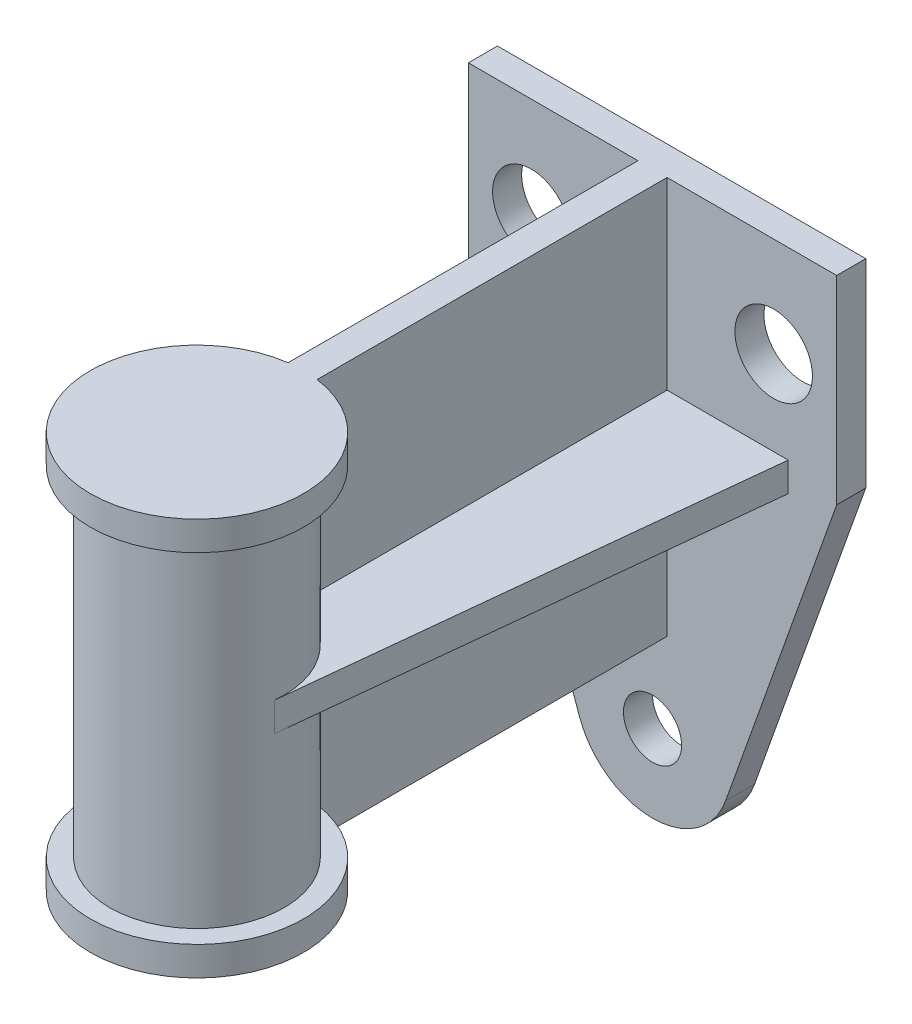
from build123d import *

# Parameters (mm, degrees)
SKETCH1_R           = 18
BOSS_EXTRUDE1_DEPTH = 41
SKETCH3_R           = 6
BOSS_EXTRUDE2_DEPTH = 6
SKETCH4_W           = 81
SKETCH4_H           = 82
BOSS_EXTRUDE3_DEPTH = 3
SKETCH6_R           = 22
BOSS_EXTRUDE4_DEPTH = 6
BOSS_EXTRUDE5_START = -6
SKETCH7_R           = 22
BOSS_EXTRUDE5_DEPTH = 6
BOSS_EXTRUDE6_DEPTH = 3
HOLE1_D             = 16
HOLE1_DEPTH         = 6


with BuildPart() as part:
    # Sketch1 → Boss-Extrude1 (new, symmetric)
    with BuildSketch(Plane(origin=(0, 0, 0), x_dir=(1, 0, 0), z_dir=(0, 1, 0))):
        with Locations(Location((0, 0, 0), (0, 0, 270))):
            Circle(SKETCH1_R)
    extrude(amount=BOSS_EXTRUDE1_DEPTH, both=True)



with BuildPart() as body_2:
    # Sketch3 → Boss-Extrude2 (new body)
    with BuildSketch(Plane.XY.offset(-100)):
        with BuildLine():
            Line((-38, 41), (38, 41))
            Line((38, 41), (38, 0))
            Line((38, 0), (15.072405416, -64.368667895))
            ThreePointArc((15.072405416, -64.368667895), (0, -75), (-15.072405416, -64.368667895))
            Line((-15.072405416, -64.368667895), (-38, 0))
            Line((-38, 0), (-38, 41))
        make_face()
        with Locations((0, -59)):
            Circle(SKETCH3_R, mode=Mode.SUBTRACT)
    extrude(amount=BOSS_EXTRUDE2_DEPTH)


with BuildPart() as part_1:
    add(part.part)

    add(body_2.part)  # Boss-Extrude3 merges body 2
    # Sketch4 → Boss-Extrude3 (add, symmetric)
    with BuildSketch(Plane(origin=(0, 0, 0), x_dir=(0, 0, -1), z_dir=(1, 0, 0))):
        with Locations((53.5, 0)):
            Rectangle(SKETCH4_W, SKETCH4_H)
    extrude(amount=BOSS_EXTRUDE3_DEPTH, both=True)

    # Sketch6 → Boss-Extrude4 (add)
    with BuildSketch(Plane(origin=(0, 41, 0), x_dir=(1, 0, 0), z_dir=(0, 1, 0))):
        Circle(SKETCH6_R)
    extrude(amount=-BOSS_EXTRUDE4_DEPTH)

    # Sketch7 → Boss-Extrude5 (add)
    with BuildSketch(Plane.XZ.offset(41).offset(BOSS_EXTRUDE5_START)):
        Circle(SKETCH7_R)
    extrude(amount=BOSS_EXTRUDE5_DEPTH)

    # Sketch8 → Boss-Extrude6 (add, symmetric)
    with BuildSketch(Plane(origin=(0, 0, 0), x_dir=(1, 0, 0), z_dir=(0, 1, 0))):
        with BuildLine():
            Line((-28, 94), (-17.900985099, -1.885399817))
            ThreePointArc((-17.900985099, -1.885399817), (0, 18), (17.900985099, -1.885399817))
            Line((17.900985099, -1.885399817), (28, 94))
            Line((28, 94), (-28, 94))
        make_face()
    extrude(amount=BOSS_EXTRUDE6_DEPTH, both=True)

    # Hole1
    with Locations(Plane.XY.offset(-94)):
        with Locations((25, 20.5), (-25, 20.5)):
            Hole(HOLE1_D / 2, depth=HOLE1_DEPTH)


solid = part_1.part
